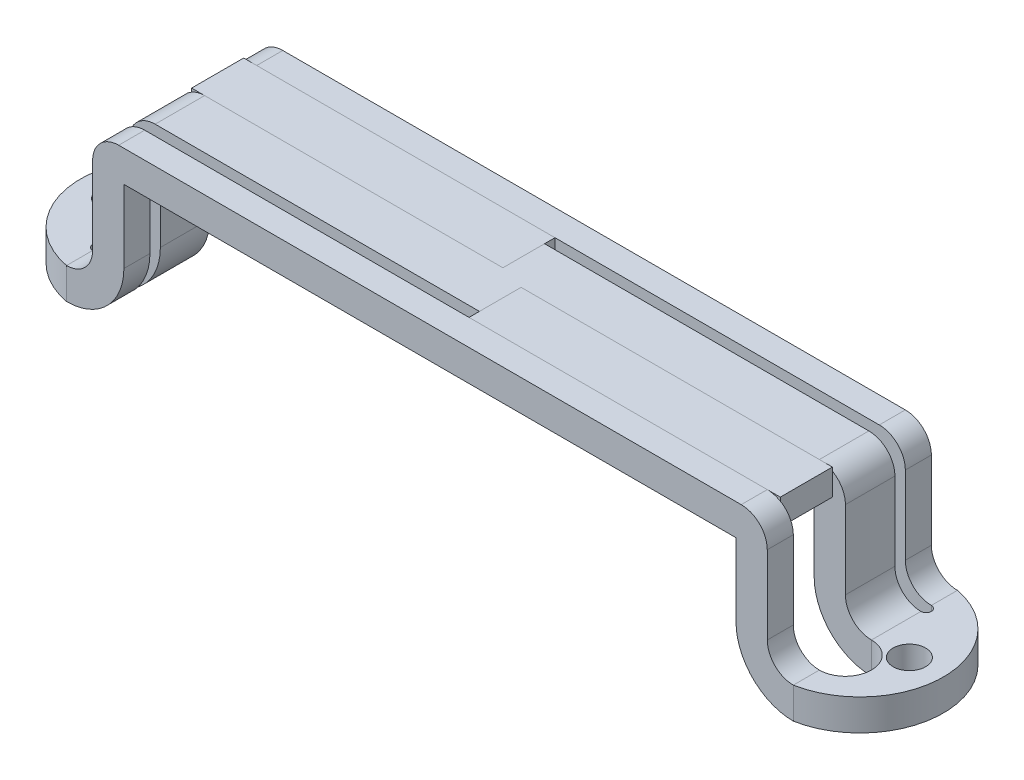
from build123d import *

# Parameters (mm, degrees)
EXTRUDE_THIN1_DEPTH   = 16.002
SKETCH2_R             = 1.5875
CUT_EXTRUDE1_DEPTH    = 48.684832332
SKETCH3_W             = 30.353
SKETCH3_H             = 5.08
BOSS_EXTRUDE1_DEPTH   = 2.54
BOSS_EXTRUDE1_2_DEPTH = 2.54


with BuildPart() as part:
    # Sketch1 → Extrude-Thin1 (new body)
    with BuildSketch(Plane.XY):
        with BuildLine():
            Line((-42.06875, -12.7), (-35.433, -12.7))
            ThreePointArc((-35.433, -12.7), (-33.636948776, -11.956051224), (-32.893, -10.16))
            Line((-32.893, -10.16), (-32.893, -2.54))
            ThreePointArc((-32.893, -2.54), (-32.149051224, -0.743948776), (-30.353, 0))
            Line((-30.353, 0), (30.353, 0))
            ThreePointArc((30.353, 0), (32.149051224, -0.743948776), (32.893, -2.54))
            Line((32.893, -2.54), (32.893, -10.16))
            ThreePointArc((32.893, -10.16), (33.636948776, -11.956051224), (35.433, -12.7))
            Line((35.433, -12.7), (42.06875, -12.7))
            Line((42.06875, -12.7), (42.06875, -15.748))
            Line((42.06875, -15.748), (35.433, -15.748))
            ThreePointArc((35.433, -15.748), (31.481687307, -14.111312693), (29.845, -10.16))
            Line((29.845, -10.16), (29.845, -3.048))
            Line((29.845, -3.048), (-29.845, -3.048))
            Line((-29.845, -3.048), (-29.845, -10.16))
            ThreePointArc((-29.845, -10.16), (-31.481687307, -14.111312693), (-35.433, -15.748))
            Line((-35.433, -15.748), (-42.06875, -15.748))
            Line((-42.06875, -15.748), (-42.06875, -12.7))
        make_face()
    extrude(amount=-EXTRUDE_THIN1_DEPTH)

    # Sketch2 → Cut-Extrude1 (cut, through all)
    with BuildSketch(Plane(origin=(0, 0, 0), x_dir=(1, 0, 0), z_dir=(0, 1, 0))):
        with BuildLine():
            ThreePointArc((-42.06875, 8.001), (-40.193949205, 13.198335352), (-35.433, 16.002))
            Line((-35.433, 16.002), (-42.06875, 16.002))
            Line((-42.06875, 16.002), (-42.06875, 8.001))
        make_face()
        with BuildLine():
            ThreePointArc((-35.433, 0), (-40.193949205, 2.803664648), (-42.06875, 8.001))
            Line((-42.06875, 8.001), (-42.06875, 0))
            Line((-42.06875, 0), (-35.433, 0))
        make_face()
        with BuildLine():
            Line((-30.353, 13.462), (-35.433, 13.462))
            ThreePointArc((-35.433, 13.462), (-37.973, 10.922), (-35.433, 8.382))
            Line((-35.433, 8.382), (-30.353, 8.382))
            Line((-30.353, 8.382), (-30.353, 13.462))
        make_face()
        Polygon((-1.27, 13.462), (-30.353, 13.462), (-30.353, 8.382), (-1.27, 8.382), (-1.27, 12.446), (30.353, 12.446), (30.353, 13.462), (0, 13.462), align=None)
        Polygon((1.27, 3.556), (-30.353, 3.556), (-30.353, 2.54), (0, 2.54), (1.27, 2.54), (30.353, 2.54), (30.353, 7.62), (1.27, 7.62), align=None)
        with BuildLine():
            Line((35.433, 7.62), (30.353, 7.62))
            Line((30.353, 7.62), (30.353, 2.54))
            Line((30.353, 2.54), (35.433, 2.54))
            ThreePointArc((35.433, 2.54), (37.973, 5.08), (35.433, 7.62))
        make_face()
        with Locations(Location((38.750875, 8.001, 0), (0, 0, 180))):
            Circle(SKETCH2_R)
        with BuildLine():
            ThreePointArc((42.06875, 8.001), (40.193949205, 2.803664648), (35.433, 0))
            Line((35.433, 0), (42.06875, 0))
            Line((42.06875, 0), (42.06875, 8.001))
        make_face()
        with BuildLine():
            ThreePointArc((35.433, 16.002), (40.193949205, 13.198335352), (42.06875, 8.001))
            Line((42.06875, 8.001), (42.06875, 16.002))
            Line((42.06875, 16.002), (35.433, 16.002))
        make_face()
        with BuildLine():
            Line((35.433, 13.462), (30.353, 13.462))
            Line((30.353, 13.462), (30.353, 12.446))
            Line((30.353, 12.446), (35.433, 12.446))
            ThreePointArc((35.433, 12.446), (35.941, 12.954), (35.433, 13.462))
        make_face()
        with BuildLine():
            Line((-30.353, 2.54), (-30.353, 3.556))
            Line((-30.353, 3.556), (-35.433, 3.556))
            ThreePointArc((-35.433, 3.556), (-35.941, 3.048), (-35.433, 2.54))
            Line((-35.433, 2.54), (-30.353, 2.54))
        make_face()
        with Locations(Location((-38.750875, 8.001, 0), (0, 0, 180))):
            Circle(SKETCH2_R)
    extrude(amount=-CUT_EXTRUDE1_DEPTH, mode=Mode.SUBTRACT)


with BuildPart() as body_2:
    # Sketch3 → Boss-Extrude1 (new body)
    with BuildSketch(Plane(origin=(0, 0, 0), x_dir=(1, 0, 0), z_dir=(0, 1, 0))):
        with Locations((-16.4465, 10.922)):
            Rectangle(SKETCH3_W, SKETCH3_H)
    extrude(amount=-BOSS_EXTRUDE1_DEPTH)


with BuildPart() as body_3:
    # Sketch3 → Boss-Extrude1 2 (new body)
    with BuildSketch(Plane(origin=(0, 0, 0), x_dir=(1, 0, 0), z_dir=(0, 1, 0))):
        with Locations((16.4465, 5.08)):
            Rectangle(SKETCH3_W, SKETCH3_H)
    extrude(amount=-BOSS_EXTRUDE1_2_DEPTH)


solid = Compound([part.part, body_2.part, body_3.part])
